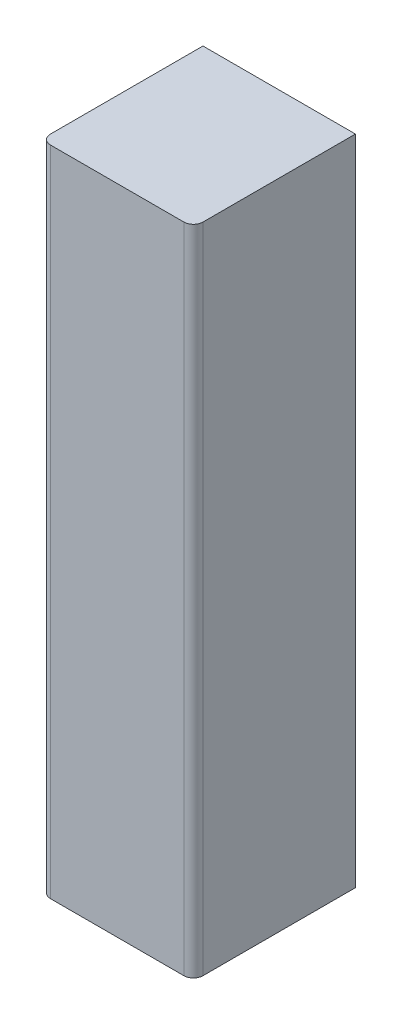
from build123d import *

# Parameters (mm, degrees)
SKETCH_1_W      = 16
SKETCH_1_H      = 68.5
EXTRUDE_1_DEPTH = 0.1
SKETCH_2_W      = 16
SKETCH_2_H      = 68.5
EXTRUDE_2_DEPTH = 16.9
FILLET_1_R      = 1


with BuildPart() as part:
    # 草图1 → 拉伸1 (new body)
    with BuildSketch(Plane.XY):
        Rectangle(SKETCH_1_W, SKETCH_1_H)
    extrude(amount=EXTRUDE_1_DEPTH)

    # 草图2 → 拉伸2 (add)
    with BuildSketch(Plane.XY.offset(0.1)):
        Rectangle(SKETCH_2_W, SKETCH_2_H)
    extrude(amount=EXTRUDE_2_DEPTH)

    # 圆角1
    fillet_1_edges = [part.edges().sort_by_distance(p)[0] for p in [
        (-8, 0, 17),
        (8, 0, 17),
    ]]
    fillet(fillet_1_edges, radius=FILLET_1_R)


solid = part.part
